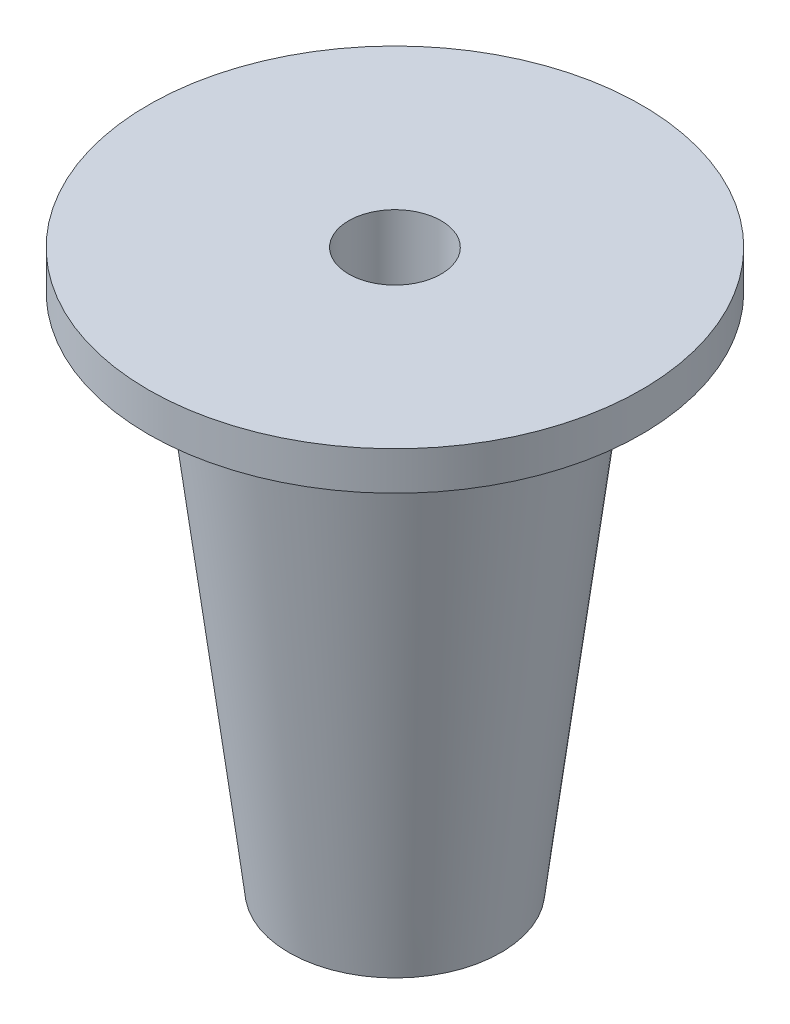
from build123d import *

# Parameters (mm, degrees)
SKETCH3_R          = 6
CUT_EXTRUDE1_DEPTH = 20


with BuildPart() as part:
    # Sketch2 → Revolve1 (revolve)
    with BuildSketch(Plane.XY, mode=Mode.PRIVATE) as revolve1_sk:
        Polygon((22.022361545, 80.36560803), (32, 80.36560803), (32, 85.36560803), (0, 85.36560803), (0, 13), (13.750904943, 13), align=None)
    revolve(revolve1_sk.sketch.rotate(Axis((0, 85.36560803, 0), (0, -1, 0)), 90), axis=Axis((0, 85.36560803, 0), (0, -1, 0)))

    # Sketch3 → Cut-Extrude1 (cut)
    with BuildSketch(Plane(origin=(0, 85.36560803, 0), x_dir=(1, 0, 0), z_dir=(0, 1, 0))):
        with Locations(Location((0, 0, 0), (0, 0, 270))):
            Circle(SKETCH3_R)
    extrude(amount=-CUT_EXTRUDE1_DEPTH, mode=Mode.SUBTRACT)


solid = part.part
